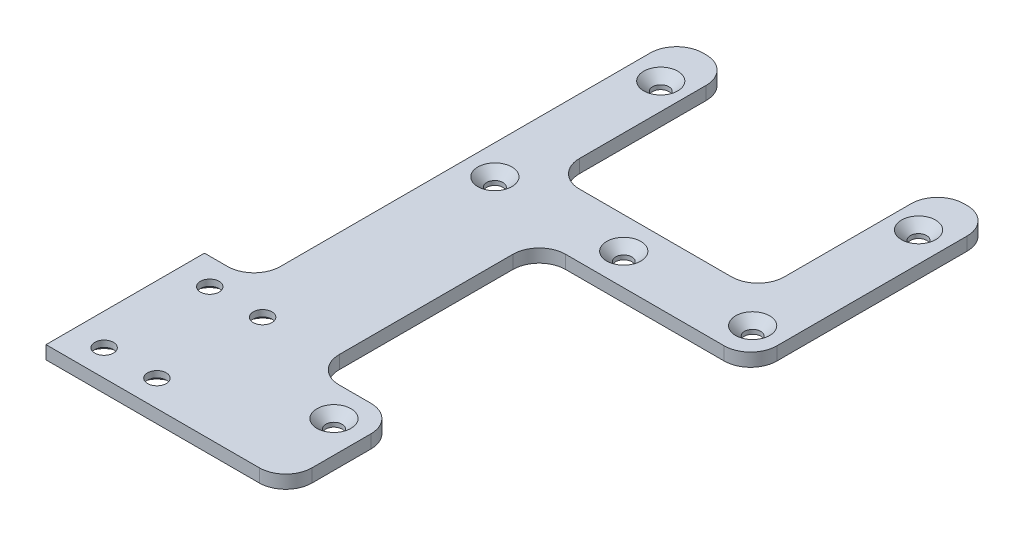
from build123d import *

# Parameters (mm, degrees)
SKETCH1_W                                      = 76.2
SKETCH1_H                                      = 177.8
BOSS_EXTRUDE1_DEPTH                            = 3.175
CSK_FOR_M3_5_FLAT_HEAD_MACHINE_SCREW1_AT_COUNT = 2
CSK_FOR_M3_5_FLAT_HEAD_MACHINE_SCREW1_AT_PITCH = 61.976
CSK_FOR_M3_5_FLAT_HEAD_MACHINE_SCREW_2_COUNT   = 2
CSK_FOR_M3_5_FLAT_HEAD_MACHINE_SCREW_2_PITCH   = 73.697214737
CSK_FOR_M3_5_FLAT_HEAD_MACHINE_SCREW_3_COUNT   = 2
CSK_FOR_M3_5_FLAT_HEAD_MACHINE_SCREW_3_PITCH   = 50.50258437
CSK_FOR_M3_5_FLAT_HEAD_MACHINE_SCREW_4_COUNT   = 2
CSK_FOR_M3_5_FLAT_HEAD_MACHINE_SCREW_4_PITCH   = 39.878
CSK_FOR_M3_5_FLAT_HEAD_MACHINE_SCREW_5_COUNT   = 2
CSK_FOR_M3_5_FLAT_HEAD_MACHINE_SCREW_5_PITCH   = 113.848594475
SKETCH7_W                                      = 11.90625
SKETCH7_H                                      = 38.1
BOSS_EXTRUDE2_DEPTH                            = 3.175
CSK_FOR_8_FLAT_HEAD_MACHINE_SCREW_2_COUNT      = 2
CSK_FOR_8_FLAT_HEAD_MACHINE_SCREW_2_PITCH      = 28.398063314
CSK_FOR_8_FLAT_HEAD_MACHINE_SCREW_3_COUNT      = 2
CSK_FOR_8_FLAT_HEAD_MACHINE_SCREW_3_PITCH      = 12.7
CSK_FOR_8_FLAT_HEAD_MACHINE_SCREW_4_COUNT      = 2
CSK_FOR_8_FLAT_HEAD_MACHINE_SCREW_4_PITCH      = 25.4
SKETCH10_W                                     = 76.2
SKETCH10_H                                     = 38.1
CUT_EXTRUDE2_DEPTH                             = 103.048594621
SKETCH11_W                                     = 49.276
SKETCH11_H                                     = 43.18
CUT_EXTRUDE3_DEPTH                             = 103.048594621
CUT_EXTRUDE4_DEPTH                             = 103.048594621
FILLET2_R                                      = 6.35
FILLET3_R                                      = 6.35


with BuildPart() as part:
    # Sketch1 → Boss-Extrude1 (new body)
    with BuildSketch(Plane(origin=(0, 0, 0), x_dir=(1, 0, 0), z_dir=(0, 1, 0))):
        Rectangle(SKETCH1_W, SKETCH1_H)
    extrude(amount=BOSS_EXTRUDE1_DEPTH)

    # Sketch5 → CSK for M3.5 Flat Head Machine Screw1 (revolve, cut)
    with BuildSketch(Plane(origin=(-30.988, 3.175, -77.978), x_dir=(0, 0, 1), z_dir=(1, 0, 0))):
        Polygon((0, 0), (0, 3.175), (1.95, 3.175), (1.95, 2.15), (4.1, 0), align=None)
    csk_for_m3_5_flat_head_machine_screw1 = revolve(axis=Axis((-30.988, 9.525, -77.978), (0, -1, 0)), mode=Mode.SUBTRACT)

    # CSK for M3.5 Flat Head Machine Screw1 at: CSK for M3.5 Flat Head Machine Screw1 ×2
    with Locations(*[(i * CSK_FOR_M3_5_FLAT_HEAD_MACHINE_SCREW1_AT_PITCH, 0, 0) for i in range(1, CSK_FOR_M3_5_FLAT_HEAD_MACHINE_SCREW1_AT_COUNT)]):
        add(csk_for_m3_5_flat_head_machine_screw1, mode=Mode.SUBTRACT)

    # CSK for M3.5 Flat Head Machine Screw 2: CSK for M3.5 Flat Head Machine Screw1 ×2
    with Locations(*[Vector(0.8409544406952484, 0, 0.5411059311030901) * (i * CSK_FOR_M3_5_FLAT_HEAD_MACHINE_SCREW_2_PITCH) for i in range(1, CSK_FOR_M3_5_FLAT_HEAD_MACHINE_SCREW_2_COUNT)]):
        add(csk_for_m3_5_flat_head_machine_screw1, mode=Mode.SUBTRACT)

    # CSK for M3.5 Flat Head Machine Screw 3: CSK for M3.5 Flat Head Machine Screw1 ×2
    with Locations(*[Vector(0.6135923613981475, 0, 0.7896229568812226) * (i * CSK_FOR_M3_5_FLAT_HEAD_MACHINE_SCREW_3_PITCH) for i in range(1, CSK_FOR_M3_5_FLAT_HEAD_MACHINE_SCREW_3_COUNT)]):
        add(csk_for_m3_5_flat_head_machine_screw1, mode=Mode.SUBTRACT)

    # CSK for M3.5 Flat Head Machine Screw 4: CSK for M3.5 Flat Head Machine Screw1 ×2
    with Locations(*[(0, 0, i * CSK_FOR_M3_5_FLAT_HEAD_MACHINE_SCREW_4_PITCH) for i in range(1, CSK_FOR_M3_5_FLAT_HEAD_MACHINE_SCREW_4_COUNT)]):
        add(csk_for_m3_5_flat_head_machine_screw1, mode=Mode.SUBTRACT)

    # CSK for M3.5 Flat Head Machine Screw 5: CSK for M3.5 Flat Head Machine Screw1 ×2
    with Locations(*[Vector(0.27218605677803737, 0, 0.9622446417079302) * (i * CSK_FOR_M3_5_FLAT_HEAD_MACHINE_SCREW_5_PITCH) for i in range(1, CSK_FOR_M3_5_FLAT_HEAD_MACHINE_SCREW_5_COUNT)]):
        add(csk_for_m3_5_flat_head_machine_screw1, mode=Mode.SUBTRACT)

    # Sketch7 → Boss-Extrude2 (add)
    with BuildSketch(Plane.XZ):
        with Locations((-44.053125, 31.75)):
            Rectangle(SKETCH7_W, SKETCH7_H)
    extrude(amount=-BOSS_EXTRUDE2_DEPTH)

    # Sketch8 → CSK for #8 Flat Head Machine Screw (100)1 (revolve, cut)
    with BuildSketch(Plane(origin=(-29.68625, 0, 44.45), x_dir=(0, 0, -1), z_dir=(1, 0, 0))):
        Polygon((0, 0), (0, 3.17505), (2.2479, 3.17505), (2.2479, 1.651767624), (4.2164, 0), align=None)
    csk_for_8_flat_head_machine_screw_100 = revolve(axis=Axis((-29.68625, -6.35, 44.45), (0, 1, 0)), mode=Mode.SUBTRACT)

    # CSK for _8 Flat Head Machine Screw _ 2: CSK for #8 Flat Head Machine Screw (100)1 ×2
    with Locations(*[Vector(-0.44721359549995776, 0, -0.8944271909999161) * (i * CSK_FOR_8_FLAT_HEAD_MACHINE_SCREW_2_PITCH) for i in range(1, CSK_FOR_8_FLAT_HEAD_MACHINE_SCREW_2_COUNT)]):
        add(csk_for_8_flat_head_machine_screw_100, mode=Mode.SUBTRACT)

    # CSK for _8 Flat Head Machine Screw _ 3: CSK for #8 Flat Head Machine Screw (100)1 ×2
    with Locations(*[(-i * CSK_FOR_8_FLAT_HEAD_MACHINE_SCREW_3_PITCH, 0, 0) for i in range(1, CSK_FOR_8_FLAT_HEAD_MACHINE_SCREW_3_COUNT)]):
        add(csk_for_8_flat_head_machine_screw_100, mode=Mode.SUBTRACT)

    # CSK for _8 Flat Head Machine Screw _ 4: CSK for #8 Flat Head Machine Screw (100)1 ×2
    with Locations(*[(0, 0, -i * CSK_FOR_8_FLAT_HEAD_MACHINE_SCREW_4_PITCH) for i in range(1, CSK_FOR_8_FLAT_HEAD_MACHINE_SCREW_4_COUNT)]):
        add(csk_for_8_flat_head_machine_screw_100, mode=Mode.SUBTRACT)

    # Sketch10 → Cut-Extrude2 (cut, through all)
    with BuildSketch(Plane.XZ):
        with Locations((0, 69.85)):
            Rectangle(SKETCH10_W, SKETCH10_H)
    extrude(amount=-CUT_EXTRUDE2_DEPTH, mode=Mode.SUBTRACT)

    # Sketch11 → Cut-Extrude3 (cut, through all)
    with BuildSketch(Plane.XZ):
        with Locations((0, -67.31)):
            Rectangle(SKETCH11_W, SKETCH11_H)
    extrude(amount=-CUT_EXTRUDE3_DEPTH, mode=Mode.SUBTRACT)

    # Sketch12 → Cut-Extrude4 (cut, through all)
    with BuildSketch(Plane.XZ):
        Polygon((7.62, 50.8), (7.62, 23.9522), (-12.7, 23.9522), (-12.7, -30.48), (38.1, -30.48), (38.1, 50.8), align=None)
    extrude(amount=-CUT_EXTRUDE4_DEPTH, mode=Mode.SUBTRACT)

    # Fillet2
    fillet2_edges = [part.edges().sort_by_distance(p)[0] for p in [
        (24.638, 1.5875, -45.72),
        (-24.638, 1.5875, -45.72),
        (38.1, 1.5875, -30.48),
        (-12.7, 1.5875, -30.48),
        (-12.7, 1.5875, 23.9522),
        (7.62, 1.5875, 23.9522),
        (-38.1, 1.5875, 12.7),
    ]]
    fillet(fillet2_edges, radius=FILLET2_R)

    # Fillet3
    fillet3_edges = [part.edges().sort_by_distance(p)[0] for p in [
        (-38.1, 1.5875, -88.9),
        (-24.638, 1.5875, -88.9),
        (24.638, 1.5875, -88.9),
        (38.1, 1.5875, -88.9),
        (7.62, 1.5875, 50.8),
    ]]
    fillet(fillet3_edges, radius=FILLET3_R)


solid = part.part
